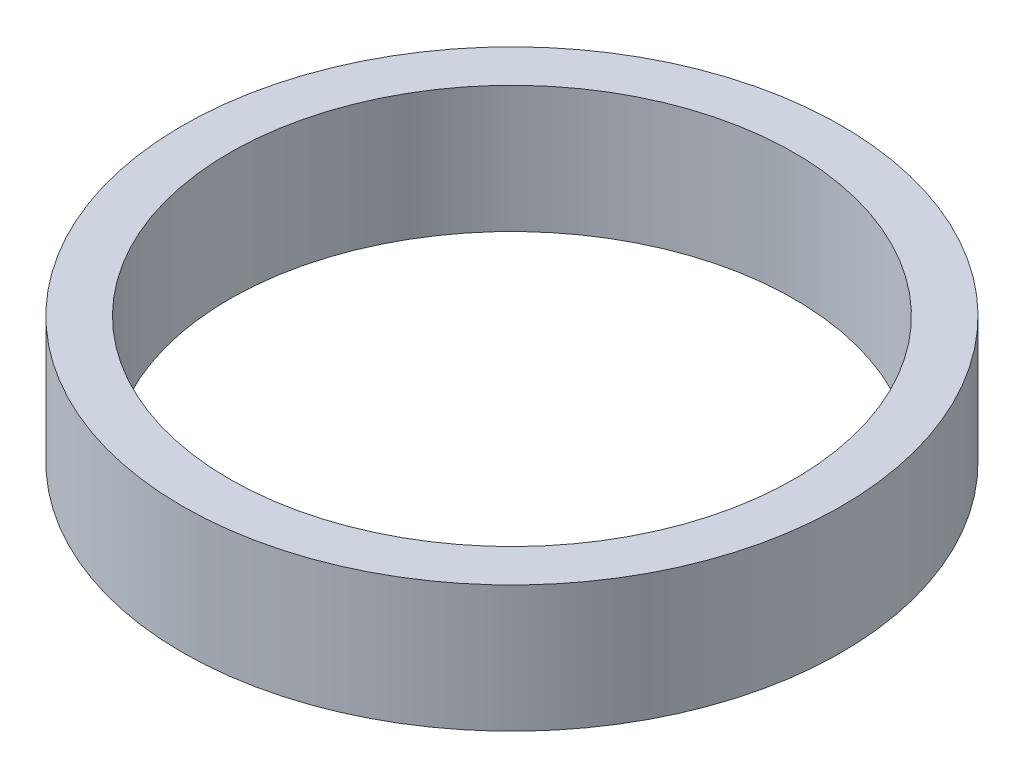
from build123d import *

# Parameters (mm, degrees)
SKETCH1_W = 1
SKETCH1_H = 2.69


with BuildPart() as part:
    # Sketch1 → Revolve1 (revolve)
    with BuildSketch(Plane.XY):
        with Locations((-6.5, 2.905)):
            Rectangle(SKETCH1_W, SKETCH1_H)
    revolve(axis=Axis((0, 0, 0), (0, -1, 0)))


solid = part.part
